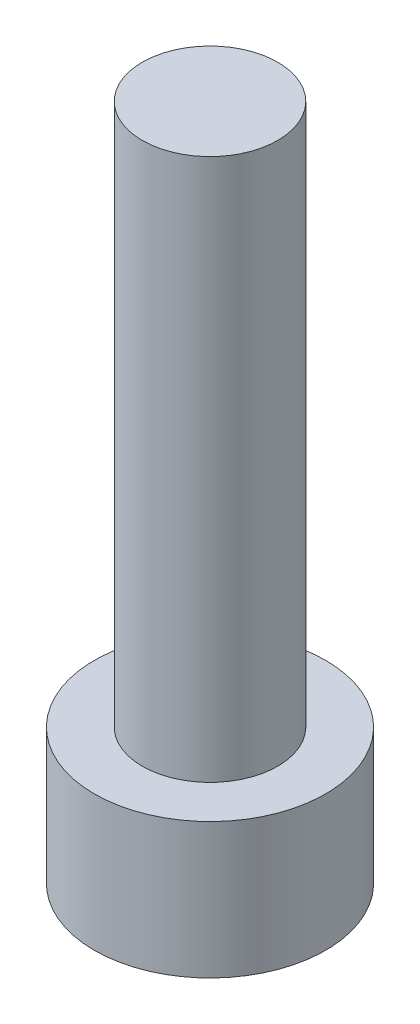
from build123d import *

# Parameters (mm, degrees)
SKETCH1_R           = 3.415
BOSS_EXTRUDE1_DEPTH = 4
SKETCH2_R           = 2
BOSS_EXTRUDE2_DEPTH = 16


with BuildPart() as part:
    # Sketch1 → Boss-Extrude1 (new body)
    with BuildSketch(Plane(origin=(0, 0, 0), x_dir=(1, 0, 0), z_dir=(0, 1, 0))):
        with Locations(Location((0, 0, 0), (0, 0, 270))):
            Circle(SKETCH1_R)
    extrude(amount=BOSS_EXTRUDE1_DEPTH)

    # Sketch2 → Boss-Extrude2 (add)
    with BuildSketch(Plane(origin=(0, 4, 0), x_dir=(1, 0, 0), z_dir=(0, 1, 0))):
        with Locations(Location((0, 0, 0), (0, 0, 270))):
            Circle(SKETCH2_R)
    extrude(amount=BOSS_EXTRUDE2_DEPTH)


solid = part.part
